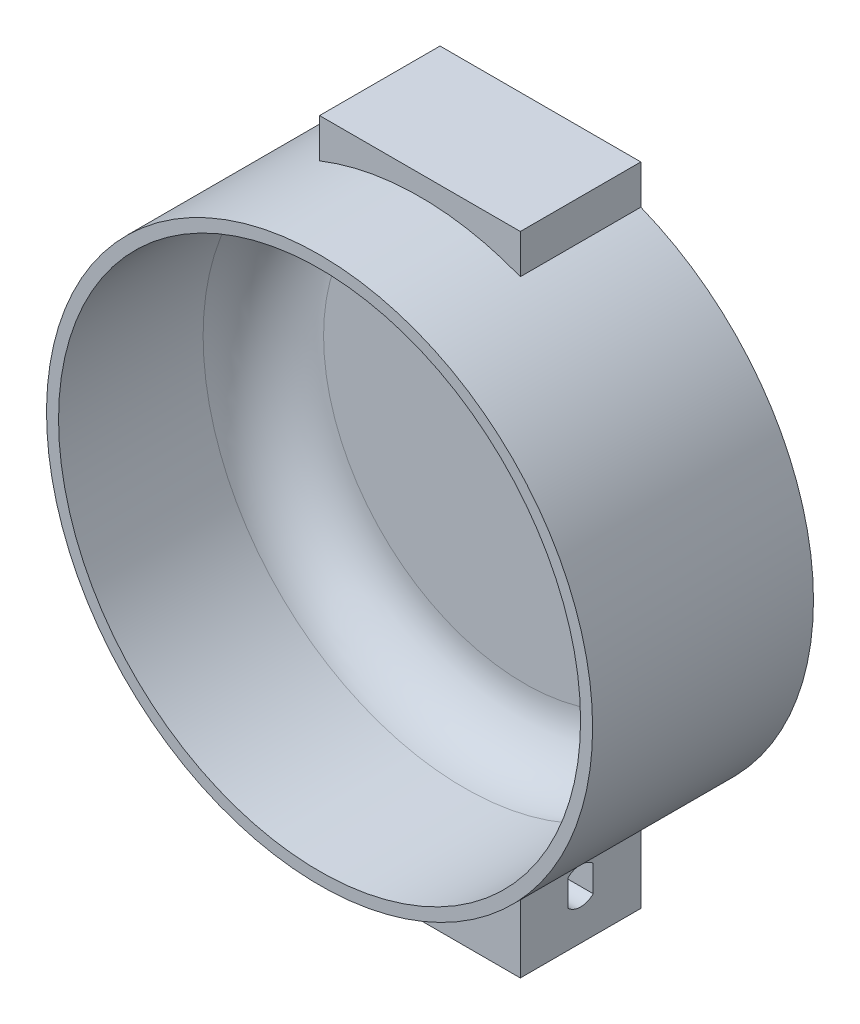
from build123d import *

# Parameters (mm, degrees)
SKETCH_1_R               = 68
SKETCH_1_R_2             = 65
EXTRUDE_1_DEPTH          = 55
SKETCH_2_R               = 68
EXTRUDE_1_2_DEPTH        = 4
FILLET_1_R               = 15
EXTRUDE_2_DEPTH          = 30
SKETCH_4_W               = 50
SKETCH_4_H               = 30
EXTRUDE_3_DEPTH          = 15
CUT_EXTRUDE_1_DEPTH      = 40
CUT_EXTRUDE_2_DEPTH      = 10
CUT_EXTRUDE_2_DEPTH_BACK = 20


with BuildPart() as part:
    # 草图1 → Extrude 1 (new body)
    with BuildSketch(Plane.XY):
        Circle(SKETCH_1_R)
        Circle(SKETCH_1_R_2, mode=Mode.SUBTRACT)
    extrude(amount=EXTRUDE_1_DEPTH)

    # 草图2 → Extrude 1 2 (add)
    with BuildSketch(Plane(origin=(0, 0, 0), x_dir=(-1, 0, 0), z_dir=(0, 0, -1))):
        with Locations(Location((0, 0, 0), (0, 0, 180))):
            Circle(SKETCH_2_R)
    extrude(amount=-EXTRUDE_1_2_DEPTH)

    # 圆角1
    fillet_1_edges = [part.edges().sort_by_distance(p)[0] for p in [
        (-65, 0, 4),
    ]]
    fillet(fillet_1_edges, radius=FILLET_1_R)

    # 草图3 → 凸台-拉伸2 (add)
    with BuildSketch(Plane(origin=(0, 0, 0), x_dir=(-1, 0, 0), z_dir=(0, 0, -1))):
        with BuildLine():
            Line((25, -73), (25, -63.237647015))
            ThreePointArc((25, -63.237647015), (12.724779035, -66.798802373), (0, -68))
            ThreePointArc((0, -68), (-12.724779035, -66.798802373), (-25, -63.237647015))
            Line((-25, -63.237647015), (-25, -73))
            Line((-25, -73), (25, -73))
        make_face()
        with BuildLine():
            ThreePointArc((-25, 63.237647015), (-12.724779035, 66.798802373), (0, 68))
            ThreePointArc((0, 68), (12.724779035, 66.798802373), (25, 63.237647015))
            Line((25, 63.237647015), (25, 73))
            Line((25, 73), (-25, 73))
            Line((-25, 73), (-25, 63.237647015))
        make_face()
    extrude(amount=-EXTRUDE_2_DEPTH)

    # 草图4 → 凸台-拉伸3 (add)
    with BuildSketch(Plane.XZ.offset(73)):
        with Locations((0, 15)):
            Rectangle(SKETCH_4_W, SKETCH_4_H)
    extrude(amount=EXTRUDE_3_DEPTH)

    # 草图5 → 切除-拉伸1 (cut)
    with BuildSketch(Plane(origin=(25, 0, 0), x_dir=(0, 0, -1), z_dir=(1, 0, 0))):
        with BuildLine():
            Line((-18.15, -72.335532476), (-18.15, -75.618823508))
            Line((-18.15, -75.618823508), (-11.85, -75.618823508))
            Line((-11.85, -75.618823508), (-11.85, -72.335532476))
            ThreePointArc((-11.85, -72.335532476), (-15, -71.068823508), (-18.15, -72.335532476))
        make_face()
        with BuildLine():
            Line((-11.85, -75.618823508), (-18.15, -75.618823508))
            Line((-18.15, -75.618823508), (-18.15, -78.902114539))
            ThreePointArc((-18.15, -78.902114539), (-15, -80.168823508), (-11.85, -78.902114539))
            Line((-11.85, -78.902114539), (-11.85, -75.618823508))
        make_face()
    extrude(amount=-CUT_EXTRUDE_1_DEPTH, mode=Mode.SUBTRACT)

    # 草图6 → 切除-拉伸2 (cut, two sides: drawn at the far end of the back side and taken through both)
    with BuildSketch(Plane(origin=(0, 0, 18.15), x_dir=(-1, 0, 0), z_dir=(0, 0, -1)).offset(-CUT_EXTRUDE_2_DEPTH_BACK)):
        with BuildLine():
            ThreePointArc((7.768196181, -75.618823508), (4.968196181, -72.818823508), (2.168196181, -75.618823508))
            Line((2.168196181, -75.618823508), (7.768196181, -75.618823508))
        make_face()
        with BuildLine():
            Line((7.768196181, -75.618823508), (2.168196181, -75.618823508))
            ThreePointArc((2.168196181, -75.618823508), (4.968196181, -78.418823508), (7.768196181, -75.618823508))
        make_face()
    extrude(amount=CUT_EXTRUDE_2_DEPTH + CUT_EXTRUDE_2_DEPTH_BACK, mode=Mode.SUBTRACT)


solid = part.part
